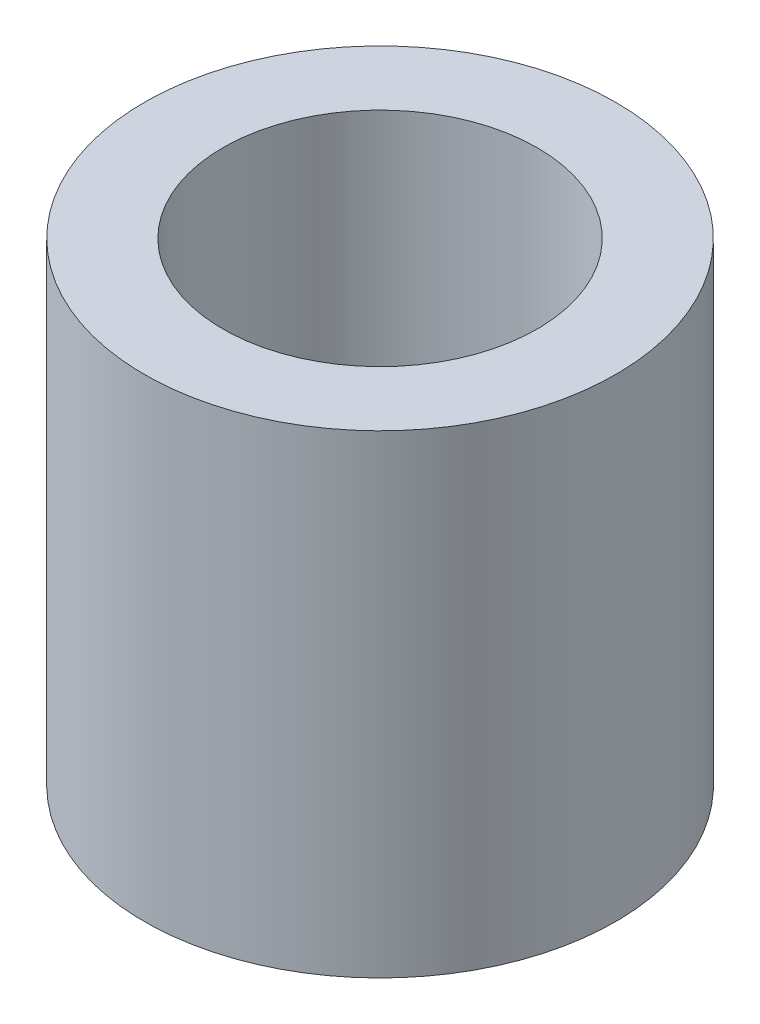
from build123d import *

# Parameters (mm, degrees)
SKETCH_1_R      = 3
SKETCH_1_R_2    = 2
EXTRUDE_1_DEPTH = 6.03156727


with BuildPart() as part:
    # 草图1 → 凸台-拉伸1 (new body)
    with BuildSketch(Plane(origin=(0, 0, 0), x_dir=(1, 0, 0), z_dir=(0, 1, 0))):
        with Locations(Location((0, 0, 0), (0, 0, 90))):
            Circle(SKETCH_1_R)
        with Locations(Location((0, 0, 0), (0, 0, 90))):
            Circle(SKETCH_1_R_2, mode=Mode.SUBTRACT)
    extrude(amount=EXTRUDE_1_DEPTH)


solid = part.part
